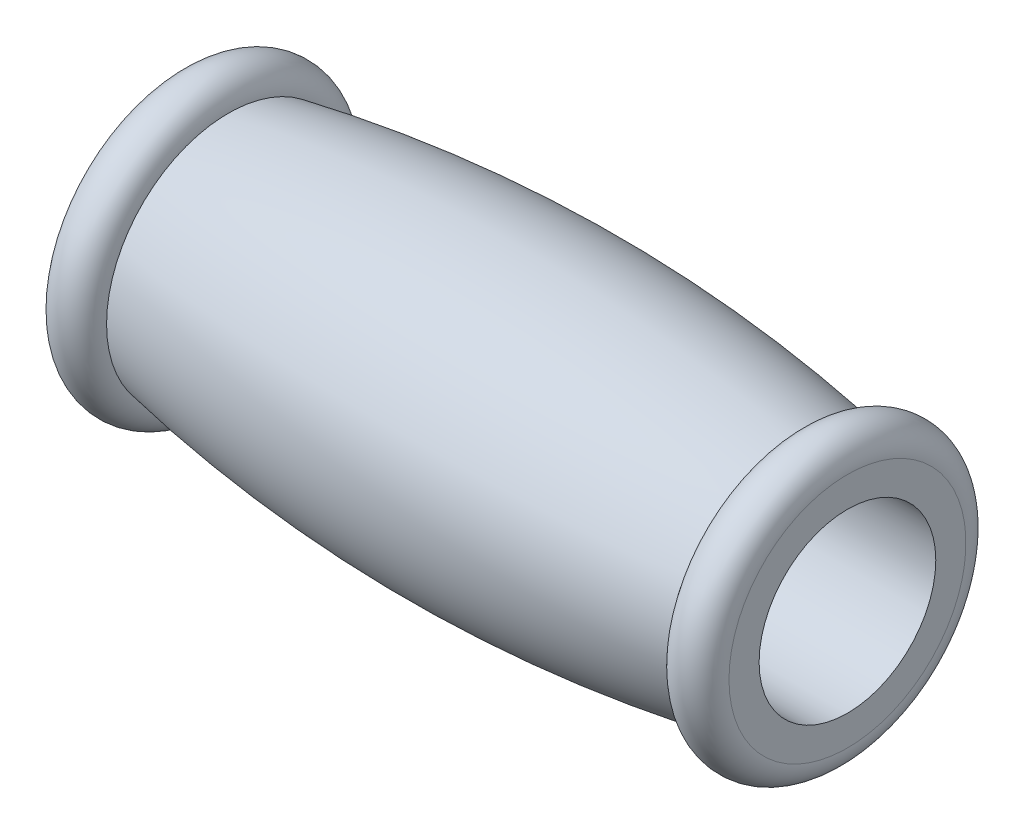
from build123d import *


with BuildPart() as part:
    # Sketch1 → Revolve1 (revolve)
    with BuildSketch(Plane.XY, mode=Mode.PRIVATE) as revolve1_sk:
        with BuildLine():
            Line((-50, 13.2), (50, 13.2))
            Line((50, 13.2), (50, 17.7))
            ThreePointArc((50, 17.7), (46.5, 21.7), (42.5, 18.2))
            ThreePointArc((42.5, 18.2), (0, 22.170858661), (-42.5, 18.2))
            ThreePointArc((-42.5, 18.2), (-46.25, 21.95), (-50, 18.2))
            Line((-50, 18.2), (-50, 13.2))
        make_face()
    revolve(revolve1_sk.sketch.rotate(Axis((-100, 0, 0), (1, 0, 0)), 90), axis=Axis((-100, 0, 0), (1, 0, 0)))


solid = part.part
